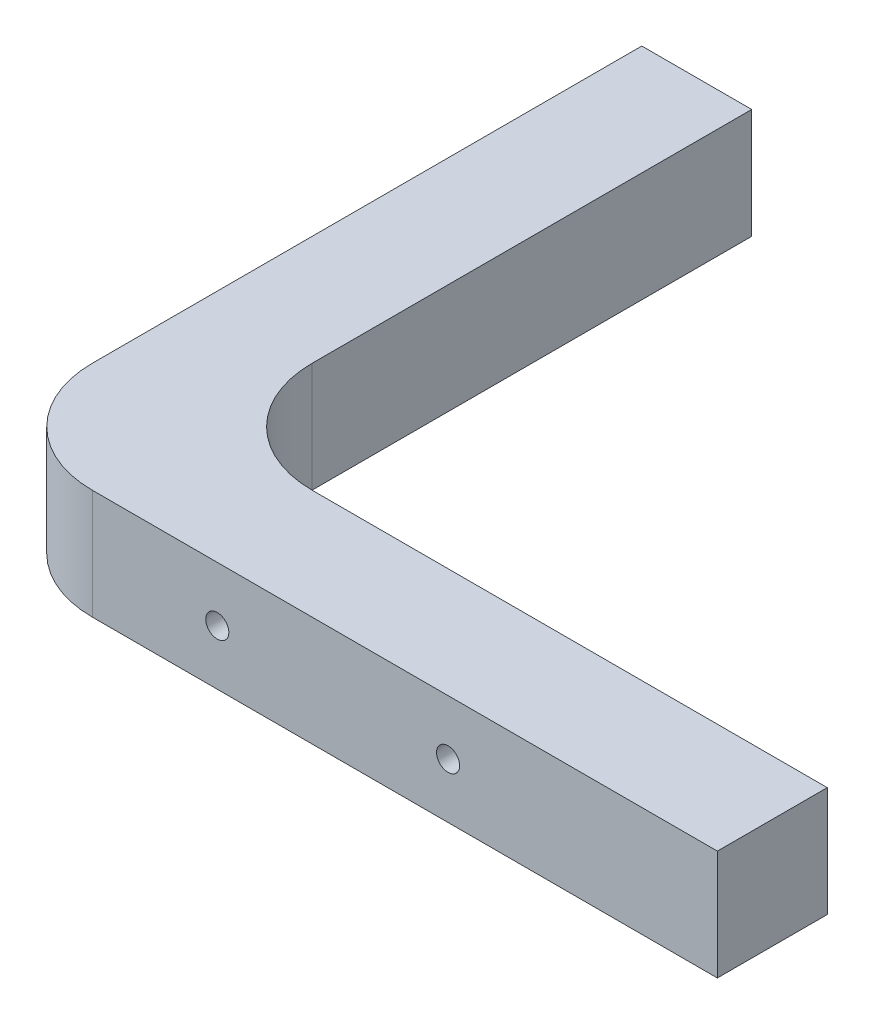
from build123d import *

# Parameters (mm, degrees)
BOSS_EXTRUDE1_DEPTH = 20
FILLET1_R           = 20
SKETCH2_R           = 2.1
CUT_EXTRUDE1_DEPTH  = 20


with BuildPart() as part:
    # Sketch1 → Boss-Extrude1 (new body)
    with BuildSketch(Plane(origin=(0, 0, 0), x_dir=(1, 0, 0), z_dir=(0, 1, 0))):
        Polygon((-113.75, 10), (0, 10), (0, -10), (-133.75, -10), (-133.75, 110), (-113.75, 110), align=None)
    extrude(amount=BOSS_EXTRUDE1_DEPTH)

    # Fillet1
    fillet1_edges = [part.edges().sort_by_distance(p)[0] for p in [
        (-133.75, 10, 10),
        (-113.75, 10, -10),
    ]]
    fillet(fillet1_edges, radius=FILLET1_R)

    # Sketch2 → Cut-Extrude1 (cut)
    with BuildSketch(Plane(origin=(0, 0, -10), x_dir=(-1, 0, 0), z_dir=(0, 0, -1))):
        with Locations((49, 10)):
            Circle(SKETCH2_R)
        with Locations((91, 10)):
            Circle(SKETCH2_R)
    extrude(amount=-CUT_EXTRUDE1_DEPTH, mode=Mode.SUBTRACT)


solid = part.part
